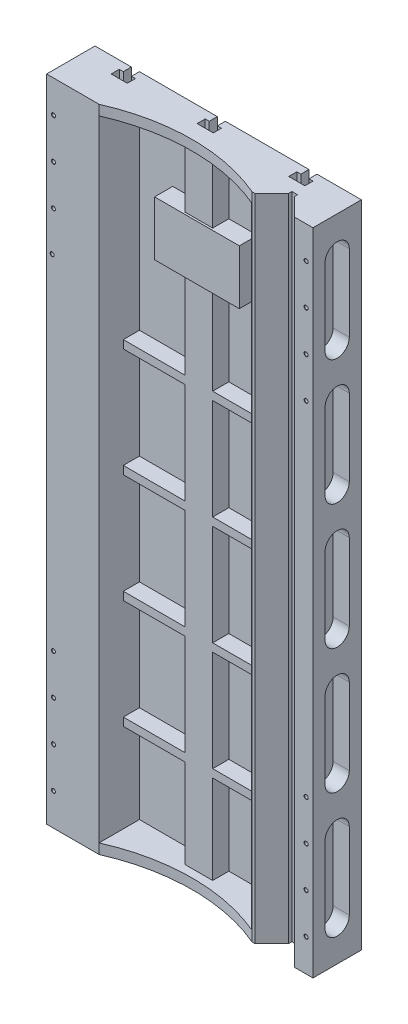
from build123d import *

# Parameters (mm, degrees)
SKETCH_1_W                    = 660
SKETCH_1_H                    = 1610
EXTRUDE_2_DEPTH               = 120
SKETCH_9_W                    = 375
SKETCH_9_H                    = 1560
CUT_EXTRUDE_1_DEPTH           = 100
SKETCH_16_W                   = 375
SKETCH_16_H                   = 20
EXTRUDE_4_DEPTH               = 40
PATTERN_LINEAR_1_COUNT        = 4
PATTERN_LINEAR_1_PITCH        = 270
SKETCH_12_W                   = 68
SKETCH_12_H                   = 1560
EXTRUDE_5_DEPTH               = 40
CUT_EXTRUDE_2_DEPTH           = 40
CUT_EXTRUDE_3_DEPTH           = 1648.847080284
PATTERN_LINEAR_5_COUNT        = 5
PATTERN_LINEAR_5_PITCH        = 310
PATTERN_LINEAR_6_COUNT        = 2
PATTERN_LINEAR_6_PITCH        = 620
PATTERN_LINEAR_6_COPY_1_DEPTH = 40
PATTERN_LINEAR_6_COPY_2_DEPTH = 40
PATTERN_LINEAR_6_COPY_3_DEPTH = 40
PATTERN_LINEAR_6_COPY_4_DEPTH = 40
CUT_EXTRUDE_5_DEPTH           = 1648.847080284
PATTERN_LINEAR_7_COUNT        = 2
PATTERN_LINEAR_7_PITCH        = 440
CUT_EXTRUDE_6_DEPTH           = 1648.847080284
SKETCH_46_W                   = 71
SKETCH_46_H                   = 135
EXTRUDE_7_DEPTH               = 40
PATTERN_LINEAR_9_COPY_1_DEPTH = 1648.847080284
PATTERN_LINEAR_9_COPY_2_DEPTH = 1648.847080284
SKETCH_49_W                   = 210
SKETCH_49_H                   = 135
EXTRUDE_8_DEPTH               = 5
M10X1_25_3_D                  = 8.8
M10X1_25_3_DEPTH              = 49.356213276
M10X1_25_3_CSINK_D            = 10.05
M10X1_25_3_CSINK_ANGLE        = 90
M10X1_25_3_TIP                = 2.643786724
PATTERN_LINEAR_11_COUNT       = 4
PATTERN_LINEAR_11_PITCH       = 100
PATTERN_LINEAR_12_COUNT       = 4
PATTERN_LINEAR_12_PITCH       = 100
CUT_EXTRUDE_7_REACH           = 1649.847
EXTRUDE_9_DEPTH               = 1610
CUT_EXTRUDE_8_DEPTH           = 1610
CUT_EXTRUDE_10_DEPTH          = 1610


with BuildPart() as part:
    # 草图1 → 凸台-拉伸2 (new body)
    with BuildSketch(Plane.XY):
        Rectangle(SKETCH_1_W, SKETCH_1_H)
    extrude(amount=-EXTRUDE_2_DEPTH)

    # 草图9 → 切除-拉伸1 (cut)
    with BuildSketch(Plane.XY):
        with Locations((-12.5, 0)):
            Rectangle(SKETCH_9_W, SKETCH_9_H)
    extrude(amount=-CUT_EXTRUDE_1_DEPTH, mode=Mode.SUBTRACT)

    # 草图16 → 凸台-拉伸4 (add)
    with BuildSketch(Plane.XY.offset(-100)):
        with Locations((-12.5, -550)):
            Rectangle(SKETCH_16_W, SKETCH_16_H)
    extrude_4 = extrude(amount=EXTRUDE_4_DEPTH)

    # 阵列(线性)1: 凸台-拉伸4 ×4
    with Locations(*[(0, i * PATTERN_LINEAR_1_PITCH, 0) for i in range(1, PATTERN_LINEAR_1_COUNT)]):
        add(extrude_4)

    # 草图12 → 凸台-拉伸5 (add)
    with BuildSketch(Plane.XY.offset(-100)):
        with Locations((-12.5, 0)):
            Rectangle(SKETCH_12_W, SKETCH_12_H)
    extrude(amount=EXTRUDE_5_DEPTH)

    # 草图37 → 切除-拉伸2 (cut)
    with BuildSketch(Plane(origin=(330, 0, 0), x_dir=(0, 0, -1), z_dir=(1, 0, 0))):
        with BuildLine():
            Line((90, -525), (90, -715))
            ThreePointArc((90, -715), (60, -745), (30, -715))
            Line((30, -715), (30, -525))
            ThreePointArc((30, -525), (60, -495), (90, -525))
        make_face()
    cut_extrude_2 = extrude(amount=-CUT_EXTRUDE_2_DEPTH, mode=Mode.SUBTRACT)

    # 草图39 → 切除-拉伸3 (cut, through all)
    with BuildSketch(Plane.XZ.offset(805)):
        Polygon((295, 0), (251.25, -43.75), (251.25, -51.75), (237.25, -51.75), (237.25, -43.75), (193.5, 0), align=None)
    extrude(amount=-CUT_EXTRUDE_3_DEPTH, mode=Mode.SUBTRACT)

    # 阵列(线性)5: 切除-拉伸2 ×5
    with Locations(*[(0, i * PATTERN_LINEAR_5_PITCH, 0) for i in range(1, PATTERN_LINEAR_5_COUNT)]):
        add(cut_extrude_2, mode=Mode.SUBTRACT)

    # 阵列(线性)6: 切除-拉伸2 ×2
    with Locations(*[(-i * PATTERN_LINEAR_6_PITCH, 0, 0) for i in range(1, PATTERN_LINEAR_6_COUNT)]):
        add(cut_extrude_2, mode=Mode.SUBTRACT)

    # 阵列(线性)6 copy 1 sketch → 阵列(线性)6 copy 1 (cut)
    with BuildSketch(Plane(origin=(-290, 310, 0), x_dir=(0, 0, -1), z_dir=(1, 0, 0))):
        with BuildLine():
            Line((90, -525), (90, -715))
            ThreePointArc((90, -715), (60, -745), (30, -715))
            Line((30, -715), (30, -525))
            ThreePointArc((30, -525), (60, -495), (90, -525))
        make_face()
    extrude(amount=-PATTERN_LINEAR_6_COPY_1_DEPTH, mode=Mode.SUBTRACT)

    # 阵列(线性)6 copy 2 sketch → 阵列(线性)6 copy 2 (cut)
    with BuildSketch(Plane(origin=(-290, 620, 0), x_dir=(0, 0, -1), z_dir=(1, 0, 0))):
        with BuildLine():
            Line((90, -525), (90, -715))
            ThreePointArc((90, -715), (60, -745), (30, -715))
            Line((30, -715), (30, -525))
            ThreePointArc((30, -525), (60, -495), (90, -525))
        make_face()
    extrude(amount=-PATTERN_LINEAR_6_COPY_2_DEPTH, mode=Mode.SUBTRACT)

    # 阵列(线性)6 copy 3 sketch → 阵列(线性)6 copy 3 (cut)
    with BuildSketch(Plane(origin=(-290, 930, 0), x_dir=(0, 0, -1), z_dir=(1, 0, 0))):
        with BuildLine():
            Line((90, -525), (90, -715))
            ThreePointArc((90, -715), (60, -745), (30, -715))
            Line((30, -715), (30, -525))
            ThreePointArc((30, -525), (60, -495), (90, -525))
        make_face()
    extrude(amount=-PATTERN_LINEAR_6_COPY_3_DEPTH, mode=Mode.SUBTRACT)

    # 阵列(线性)6 copy 4 sketch → 阵列(线性)6 copy 4 (cut)
    with BuildSketch(Plane(origin=(-290, 1240, 0), x_dir=(0, 0, -1), z_dir=(1, 0, 0))):
        with BuildLine():
            Line((90, -525), (90, -715))
            ThreePointArc((90, -715), (60, -745), (30, -715))
            Line((30, -715), (30, -525))
            ThreePointArc((30, -525), (60, -495), (90, -525))
        make_face()
    extrude(amount=-PATTERN_LINEAR_6_COPY_4_DEPTH, mode=Mode.SUBTRACT)

    # 草图41 → 切除-拉伸5 (cut, through all)
    with BuildSketch(Plane.XZ.offset(805)):
        Polygon((200, -120), (210, -120), (210, -80), (190, -80), (190, -100), (200, -100), align=None)
        Polygon((210, -120), (220, -120), (220, -100), (230, -100), (230, -80), (210, -80), align=None)
    cut_extrude_5 = extrude(amount=-CUT_EXTRUDE_5_DEPTH, mode=Mode.SUBTRACT)

    # 阵列(线性)7: 切除-拉伸5 ×2
    with Locations(*[(-i * PATTERN_LINEAR_7_PITCH, 0, 0) for i in range(1, PATTERN_LINEAR_7_COUNT)]):
        add(cut_extrude_5, mode=Mode.SUBTRACT)

    # 草图45 → 切除-拉伸6 (cut, through all)
    with BuildSketch(Plane.XZ.offset(805)):
        with BuildLine():
            Line((175, 0), (-200, 0))
            ThreePointArc((-200, 0), (-12.5, -15.762418003), (175, 0))
        make_face()
    extrude(amount=-CUT_EXTRUDE_6_DEPTH, mode=Mode.SUBTRACT)

    # 草图46 → 凸台-拉伸7 (add)
    with BuildSketch(Plane.XY.offset(-100)):
        with Locations((-82, 552.5)):
            Rectangle(SKETCH_46_W, SKETCH_46_H)
        with Locations((57, 552.5)):
            Rectangle(SKETCH_46_W, SKETCH_46_H)
    extrude(amount=EXTRUDE_7_DEPTH)

    # 阵列(线性)9 copy 1 sketch → 阵列(线性)9 copy 1 (cut, through all)
    with BuildSketch(Plane(origin=(-227, -805, 0), x_dir=(1, 0, 0), z_dir=(0, -1, 0))):
        Polygon((200, -120), (210, -120), (210, -80), (190, -80), (190, -100), (200, -100), align=None)
        Polygon((210, -120), (220, -120), (220, -100), (230, -100), (230, -80), (210, -80), align=None)
    extrude(amount=-PATTERN_LINEAR_9_COPY_1_DEPTH, mode=Mode.SUBTRACT)

    # 阵列(线性)9 copy 2 sketch → 阵列(线性)9 copy 2 (cut, through all)
    with BuildSketch(Plane(origin=(213, -805, 0), x_dir=(1, 0, 0), z_dir=(0, -1, 0))):
        Polygon((200, -120), (210, -120), (210, -80), (190, -80), (190, -100), (200, -100), align=None)
        Polygon((210, -120), (220, -120), (220, -100), (230, -100), (230, -80), (210, -80), align=None)
    extrude(amount=-PATTERN_LINEAR_9_COPY_2_DEPTH, mode=Mode.SUBTRACT)

    # 草图49 → 凸台-拉伸8 (add)
    with BuildSketch(Plane.XY.offset(-60)):
        with Locations((-12.5, 552.5)):
            Rectangle(SKETCH_49_W, SKETCH_49_H)
    extrude(amount=EXTRUDE_8_DEPTH)

    # M10x1.25 螺纹孔3
    with Locations(Plane.XY):
        with Locations((-313, -725), (-313, -625), (-313, -525), (-313, -425), (-313, 725), (-313, 625), (-313, 525), (-316.281850927, 425)):
            CounterSinkHole(M10X1_25_3_D / 2, M10X1_25_3_CSINK_D / 2, depth=M10X1_25_3_DEPTH, counter_sink_angle=M10X1_25_3_CSINK_ANGLE)
            with Locations((0, 0, -(M10X1_25_3_DEPTH + M10X1_25_3_TIP / 2))):  # 118° drill point
                Cone(0, M10X1_25_3_D / 2, M10X1_25_3_TIP, mode=Mode.SUBTRACT)

    # 草图57 → M10x1.25 螺纹孔1 (revolve, cut)
    with BuildSketch(Plane(origin=(313, -725, 0), x_dir=(0, -1, 0), z_dir=(1, 0, 0))):
        Polygon((0, 0), (0, 52), (4.4, 49.356213276), (4.4, 0.625), (5.025, 0), align=None)
    m10x1_25_1 = revolve(axis=Axis((313, -725, 6.35), (0, 0, -1)), mode=Mode.SUBTRACT)

    # 草图58 → M10x1.25 螺纹孔2 (revolve, cut)
    with BuildSketch(Plane(origin=(313, 725, 0), x_dir=(0, -1, 0), z_dir=(1, 0, 0))):
        Polygon((0, 0), (0, 52), (4.4, 49.356213276), (4.4, 0.625), (5.025, 0), align=None)
    m10x1_25_2 = revolve(axis=Axis((313, 725, 6.35), (0, 0, -1)), mode=Mode.SUBTRACT)

    # 阵列(线性)11: M10x1.25 螺纹孔2 ×4
    with Locations(*[(0, -i * PATTERN_LINEAR_11_PITCH, 0) for i in range(1, PATTERN_LINEAR_11_COUNT)]):
        add(m10x1_25_2, mode=Mode.SUBTRACT)

    # 阵列(线性)12: M10x1.25 螺纹孔1 ×4
    with Locations(*[(0, i * PATTERN_LINEAR_12_PITCH, 0) for i in range(1, PATTERN_LINEAR_12_COUNT)]):
        add(m10x1_25_1, mode=Mode.SUBTRACT)

    # 切除-拉伸7: up to this face of the body (flat: up to its plane)
    cut_extrude_7_end = Plane(part.part.faces().sort_by_distance((-7.979999089, 805, -62.775161676))[0])
    # 草图60 → 切除-拉伸7 (cut, up to the picked face)
    with BuildSketch(Plane.XZ.offset(805), mode=Mode.PRIVATE) as cut_extrude_7_sk1:
        with BuildLine():
            Line((175, 0), (181.5, 0))
            ThreePointArc((181.5, 0), (-9.25, -40), (-200, 0))
            ThreePointArc((-200, 0), (-12.5, -15.762418003), (175, 0))
        make_face()
    cut_extrude_7_tool1 = split(extrude(cut_extrude_7_sk1.sketch, amount=-CUT_EXTRUDE_7_REACH, mode=Mode.PRIVATE), bisect_by=cut_extrude_7_end, keep=Keep.BOTH, mode=Mode.PRIVATE)
    add(cut_extrude_7_tool1.solids().sort_by(Axis((-7.219461, -805, -22.151097), (0, 1, 0)))[0], mode=Mode.SUBTRACT)

    # 草图61 → 凸台-拉伸9 (add)
    with BuildSketch(Plane.XZ.offset(805)):
        Polygon((251.25, -43.75), (295, 0), (283.88, 0), (240.13, -43.75), (240.13, -51.75), (251.25, -51.75), align=None)
        Polygon((240.13, -43.75), (283.88, 0), (193.5, 0), (237.25, -43.75), (237.25, -51.75), (240.13, -51.75), align=None)
    extrude(amount=-EXTRUDE_9_DEPTH)

    # 草图61<3> → 切除-拉伸8 (cut)
    with BuildSketch(Plane.XZ.offset(805)):
        Polygon((237.25, -43.75), (193.5, 0), (182.38, 0), (226.13, -43.75), (226.13, -51.75), (237.25, -51.75), align=None)
        Polygon((240.13, -43.75), (283.88, 0), (193.5, 0), (237.25, -43.75), (237.25, -51.75), (240.13, -51.75), align=None)
    extrude(amount=-CUT_EXTRUDE_8_DEPTH, mode=Mode.SUBTRACT)

    # 草图63 → 切除-拉伸10 (cut)
    with BuildSketch(Plane.XZ.offset(805)):
        with BuildLine():
            Line((184.154169368, -1.774169368), (182.38, 0))
            Line((182.38, 0), (181.5, 0))
            ThreePointArc((181.5, 0), (179.453833435, -0.891899061), (177.403496719, -1.774169368))
            Line((177.403496719, -1.774169368), (184.154169368, -1.774169368))
        make_face()
    extrude(amount=-CUT_EXTRUDE_10_DEPTH, mode=Mode.SUBTRACT)


solid = part.part
